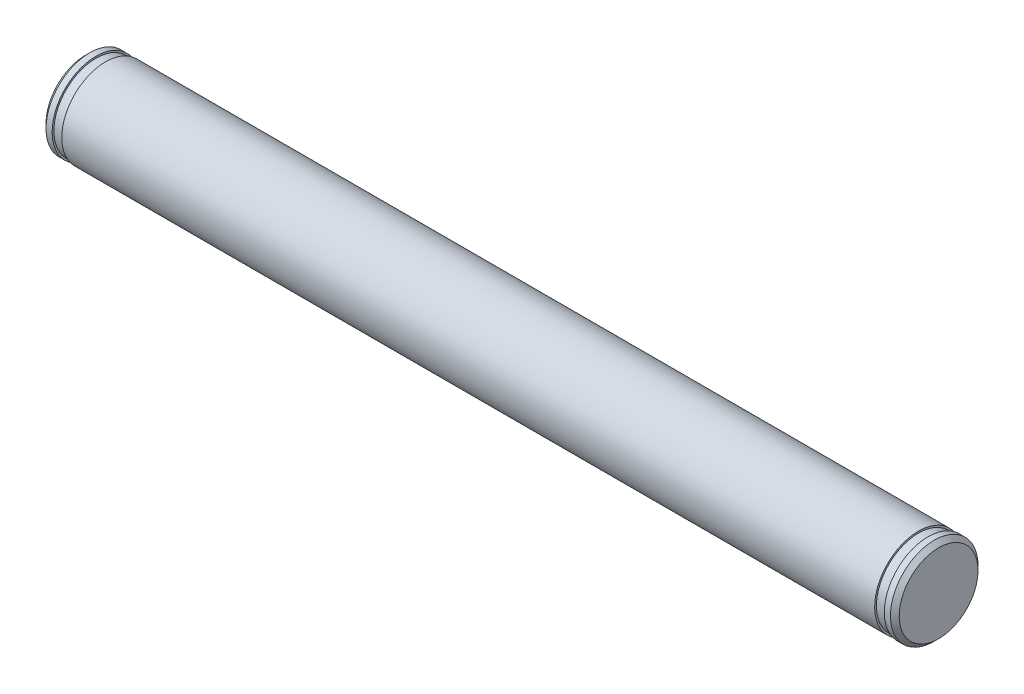
from build123d import *

# Parameters (mm, degrees)
CHAMFER_1_SIZE = 0.5


with BuildPart() as part:
    # 草图1 → 旋转1 (revolve)
    with BuildSketch(Plane.XY):
        Polygon((48.7, 0), (48.7, 5), (47.5, 5), (47.5, 4.8), (46.4, 4.8), (46.4, 5), (-46.4, 5), (-46.4, 4.8), (-47.5, 4.8), (-47.5, 5), (-48.7, 5), (-48.7, 0), align=None)
    revolve(axis=Axis((48.7, 0, 0), (-1, 0, 0)))

    # 倒角1
    chamfer_1_edges = [part.edges().sort_by_distance(p)[0] for p in [
        (-48.7, -5, 0),
        (48.7, -5, 0),
    ]]
    chamfer(chamfer_1_edges, length=CHAMFER_1_SIZE)


solid = part.part
